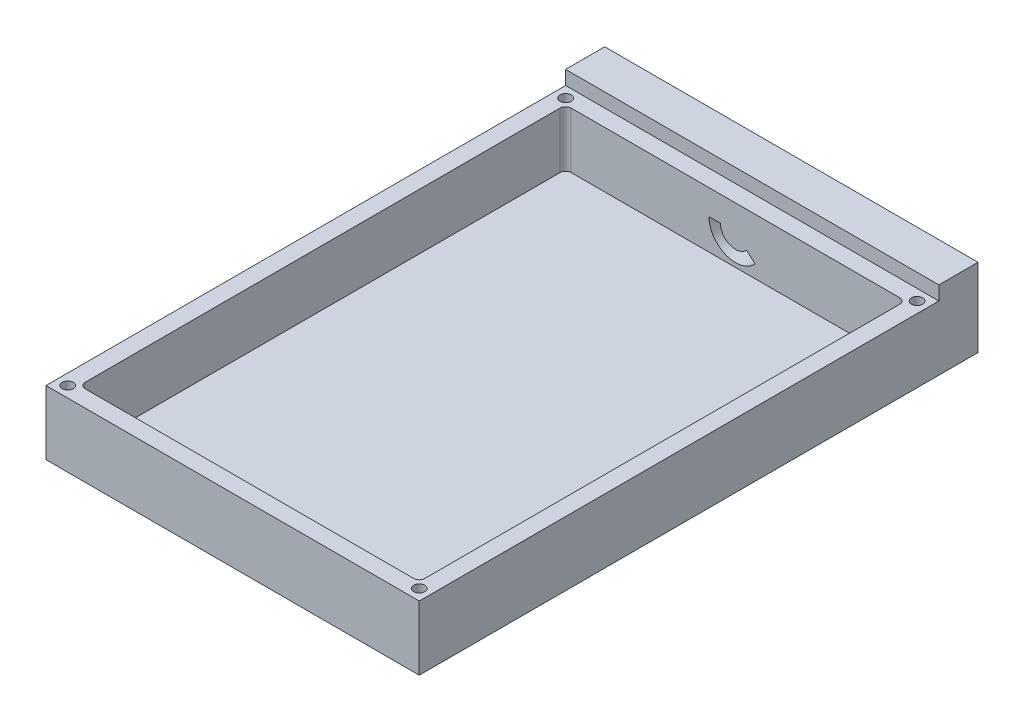
from build123d import *

# Parameters (mm, degrees)
SKETCH1_W           = 66.8
SKETCH1_H           = 14
SKETCH1_R           = 1.1
BOSS_EXTRUDE2_DEPTH = 7
SKETCH5_W           = 66.8
SKETCH5_H           = 1.5
BOSS_EXTRUDE3_DEPTH = 93
SKETCH6_W           = 66.8
SKETCH6_H           = 93
SKETCH6_R           = 1
SKETCH6_W_2         = 60.8
SKETCH6_H_2         = 87
BOSS_EXTRUDE4_DEPTH = 10
FILLET1_R           = 1
CUT_EXTRUDE1_DEPTH  = 10


with BuildPart() as part:
    # Sketch1 → Boss-Extrude2 (new body)
    with BuildSketch(Plane.XY):
        Rectangle(SKETCH1_W, SKETCH1_H)
        Circle(SKETCH1_R, mode=Mode.SUBTRACT)
    extrude(amount=BOSS_EXTRUDE2_DEPTH)

    # Sketch5 → Boss-Extrude3 (add)
    with BuildSketch(Plane.XY.offset(7)):
        with Locations((0, -6.25)):
            Rectangle(SKETCH5_W, SKETCH5_H)
    extrude(amount=BOSS_EXTRUDE3_DEPTH)

    # Sketch6 → Boss-Extrude4 (add)
    with BuildSketch(Plane(origin=(0, -5.5, 0), x_dir=(1, 0, 0), z_dir=(0, 1, 0))):
        with Locations((0, -53.5)):
            Rectangle(SKETCH6_W, SKETCH6_H)
        with Locations(Location((-31.45, -8.95, 0), (0, 0, 270))):
            Circle(SKETCH6_R, mode=Mode.SUBTRACT)
        with Locations(Location((31.45, -8.95, 0), (0, 0, 270))):
            Circle(SKETCH6_R, mode=Mode.SUBTRACT)
        with Locations(Location((31.45, -98.05, 0), (0, 0, 270))):
            Circle(SKETCH6_R, mode=Mode.SUBTRACT)
        with Locations(Location((-31.45, -98.05, 0), (0, 0, 270))):
            Circle(SKETCH6_R, mode=Mode.SUBTRACT)
        with Locations((0, -53.5)):
            Rectangle(SKETCH6_W_2, SKETCH6_H_2, mode=Mode.SUBTRACT)
    extrude(amount=BOSS_EXTRUDE4_DEPTH)

    # Fillet1
    fillet1_edges = [part.edges().sort_by_distance(p)[0] for p in [
        (30.4, -0.5, 97),
        (30.4, -0.5, 10),
        (-30.4, -0.5, 10),
        (-30.4, -0.5, 97),
    ]]
    fillet(fillet1_edges, radius=FILLET1_R)

    # Sketch2 → Cut-Extrude1 (cut)
    with BuildSketch(Plane(origin=(0, 0, 0), x_dir=(-1, 0, 0), z_dir=(0, 0, -1))):
        with BuildLine():
            Line((2.7, 0), (4.75, 0))
            ThreePointArc((4.75, 0), (1.723006094, -4.426482802), (-3.5, -3.211308145))
            Line((-3.5, -3.211308145), (-1.989473684, -1.825375156))
            ThreePointArc((-1.989473684, -1.825375156), (0.979392938, -2.516106014), (2.7, 0))
        make_face()
    extrude(amount=-CUT_EXTRUDE1_DEPTH, mode=Mode.SUBTRACT)


solid = part.part
